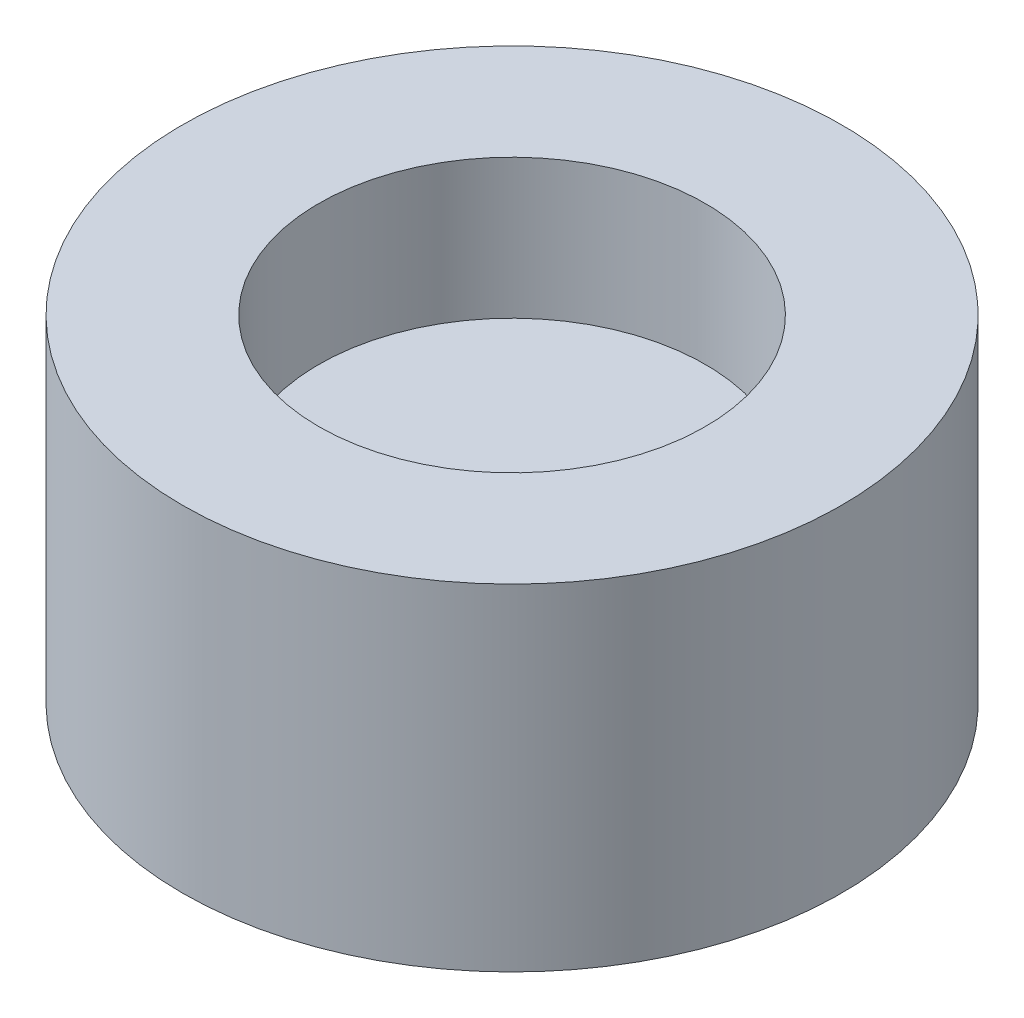
from build123d import *

# Parameters (mm, degrees)
CROQUIS1_R              = 2.95
CROQUIS1_R_2            = 1.65
SALIENTE_EXTRUIR1_DEPTH = 1.5
CROQUIS2_R              = 5.2
SALIENTE_EXTRUIR2_DEPTH = 5.3
CROQUIS3_R              = 3.05
CORTAR_EXTRUIR1_DEPTH   = 2.3
CROQUIS4_R              = 1.65
CORTAR_EXTRUIR2_DEPTH   = 4.6
SALIENTE_EXTRUIR3_START = 0.1
CROQUIS5_R              = 3.05
SALIENTE_EXTRUIR3_DEPTH = 0.1


with BuildPart() as part:
    # Croquis1 → Saliente-Extruir1 (new body)
    with BuildSketch(Plane(origin=(0, 0, 0), x_dir=(1, 0, 0), z_dir=(0, 1, 0))):
        with Locations(Location((0, 0, 0), (0, 0, 270))):
            Circle(CROQUIS1_R)
        with Locations(Location((0, 0, 0), (0, 0, 270))):
            Circle(CROQUIS1_R_2, mode=Mode.SUBTRACT)
    extrude(amount=SALIENTE_EXTRUIR1_DEPTH)

    # Croquis2 → Saliente-Extruir2 (add)
    with BuildSketch(Plane(origin=(0, 1.5, 0), x_dir=(1, 0, 0), z_dir=(0, 1, 0))):
        with Locations(Location((0, 0, 0), (0, 0, 270))):
            Circle(CROQUIS2_R)
    extrude(amount=SALIENTE_EXTRUIR2_DEPTH)

    # Croquis3 → Cortar-Extruir1 (cut)
    with BuildSketch(Plane(origin=(0, 6.8, 0), x_dir=(1, 0, 0), z_dir=(0, 1, 0))):
        with Locations(Location((0, 0, 0), (0, 0, 270))):
            Circle(CROQUIS3_R)
    extrude(amount=-CORTAR_EXTRUIR1_DEPTH, mode=Mode.SUBTRACT)

    # Croquis4 → Cortar-Extruir2 (cut)
    with BuildSketch(Plane.XZ):
        with Locations(Location((0, 0, 0), (0, 0, 90))):
            Circle(CROQUIS4_R)
    extrude(amount=-CORTAR_EXTRUIR2_DEPTH, mode=Mode.SUBTRACT)

    # Croquis5 → Saliente-Extruir3 (add)
    with BuildSketch(Plane(origin=(0, 4.5, 0), x_dir=(1, 0, 0), z_dir=(0, 1, 0)).offset(SALIENTE_EXTRUIR3_START)):
        with Locations(Location((0, 0, 0), (0, 0, 270))):
            Circle(CROQUIS5_R)
    extrude(amount=-SALIENTE_EXTRUIR3_DEPTH)


solid = part.part
